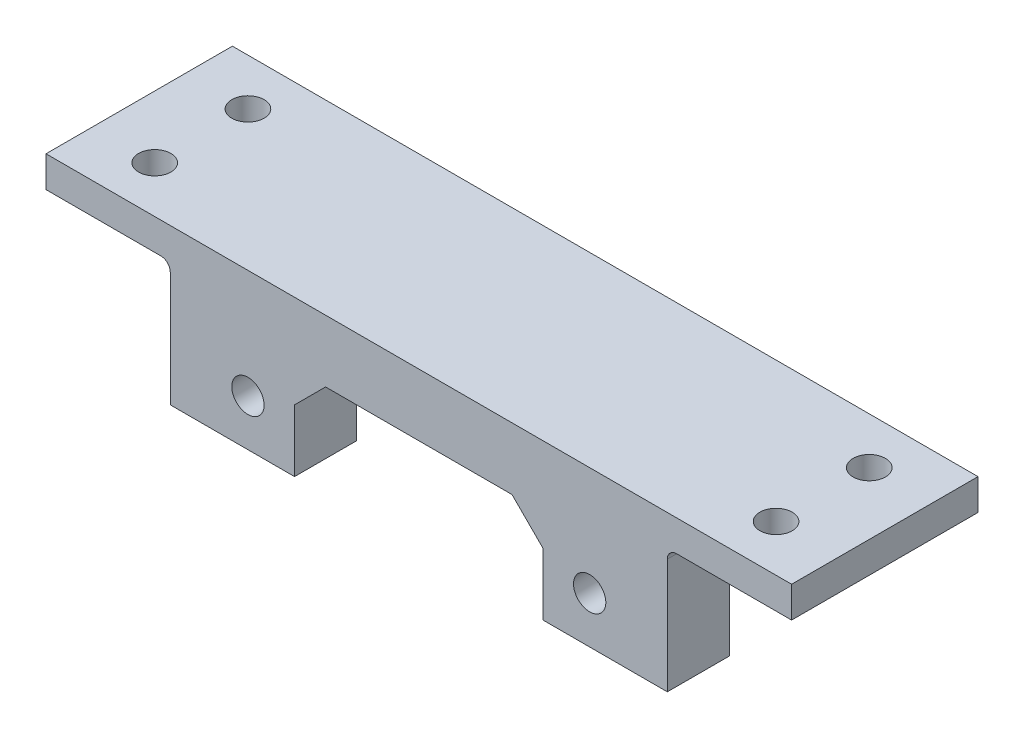
from build123d import *

# Parameters (mm, degrees)
EXTRUDE_1_DEPTH     = 30
CHAMFER_2_SIZE      = 5
SKETCH_2_R          = 2.6
CUT_EXTRUDE_1_DEPTH = 127.194294641
SKETCH_3_W          = 10
SKETCH_3_H          = 15
CUT_EXTRUDE_2_DEPTH = 107.301458127
SKETCH_4_R          = 2.6
CUT_EXTRUDE_3_DEPTH = 126.299640861
FILLET_1_R          = 1.5


with BuildPart() as part:
    # 草图1 → 凸台-拉伸1 (new body)
    with BuildSketch(Plane.XY):
        Polygon((20, 0), (20, -20), (40, -20), (40, -5), (80, -5), (80, -20), (100, -20), (100, 0), (120, 0), (120, 5), (0, 5), (0, 0), align=None)
    extrude(amount=EXTRUDE_1_DEPTH)

    # 倒角2
    chamfer_2_edges = [part.edges().sort_by_distance(p)[0] for p in [
        (80, -5, 15),
        (40, -5, 15),
    ]]
    chamfer(chamfer_2_edges, length=CHAMFER_2_SIZE)

    # 草图2 → 切除-拉伸1 (cut, through all)
    with BuildSketch(Plane(origin=(0, 5, 0), x_dir=(1, 0, 0), z_dir=(0, 1, 0))):
        with Locations(Location((10, -7.5, 0), (0, 0, 270))):
            Circle(SKETCH_2_R)
        with Locations(Location((10, -22.5, 0), (0, 0, 270))):
            Circle(SKETCH_2_R)
        with Locations(Location((110, -22.5, 0), (0, 0, 270))):
            Circle(SKETCH_2_R)
        with Locations(Location((110, -7.5, 0), (0, 0, 270))):
            Circle(SKETCH_2_R)
    extrude(amount=-CUT_EXTRUDE_1_DEPTH, mode=Mode.SUBTRACT)

    # 草图3 → 切除-拉伸2 (cut, through all)
    with BuildSketch(Plane.ZY.offset(-20)):
        with Locations((15, -12.5)):
            Rectangle(SKETCH_3_W, SKETCH_3_H)
    extrude(amount=-CUT_EXTRUDE_2_DEPTH, mode=Mode.SUBTRACT)

    # 草图4 → 切除-拉伸3 (cut, through all)
    with BuildSketch(Plane(origin=(0, 0, 0), x_dir=(-1, 0, 0), z_dir=(0, 0, -1))):
        with Locations((-87.5, -12.5)):
            Circle(SKETCH_4_R)
        with Locations((-32.5, -12.5)):
            Circle(SKETCH_4_R)
    extrude(amount=-CUT_EXTRUDE_3_DEPTH, mode=Mode.SUBTRACT)

    # 圆角1
    fillet_1_edges = [part.edges().sort_by_distance(p)[0] for p in [
        (20, 0, 15),
        (100, 0, 15),
    ]]
    fillet(fillet_1_edges, radius=FILLET_1_R)


solid = part.part
